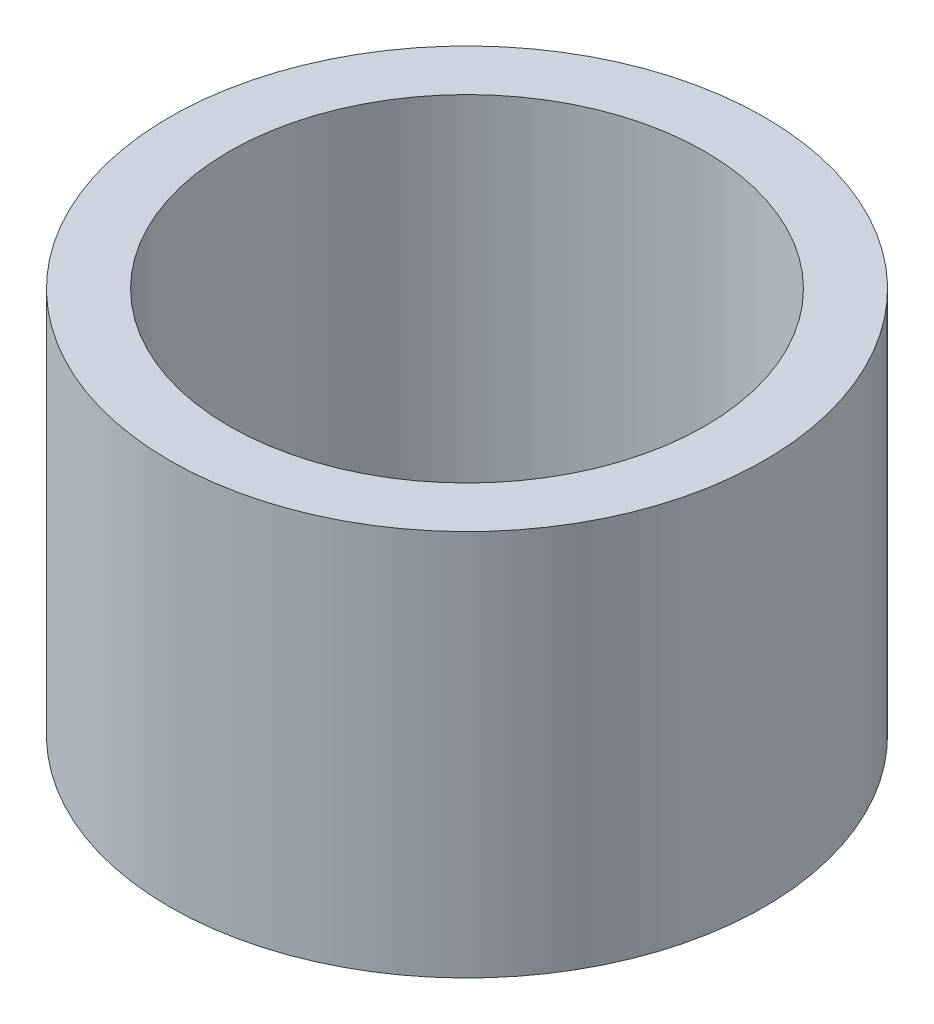
from build123d import *

# Parameters (mm, degrees)
SKETCH1_R           = 10
BOSS_EXTRUDE1_DEPTH = 13


with BuildPart() as part:
    # Sketch1 → Boss-Extrude1 (new body)
    with BuildSketch(Plane(origin=(0, 0, 0), x_dir=(1, 0, 0), z_dir=(0, 1, 0))):
        with Locations(Location((0, 0, 0), (0, 0, 90))):
            Circle(SKETCH1_R)
        with BuildLine():
            ThreePointArc((-8, 0), (0, 8), (8, 0))
            ThreePointArc((8, 0), (0, -8), (-8, 0))
        make_face(mode=Mode.SUBTRACT)
    extrude(amount=BOSS_EXTRUDE1_DEPTH)


solid = part.part
